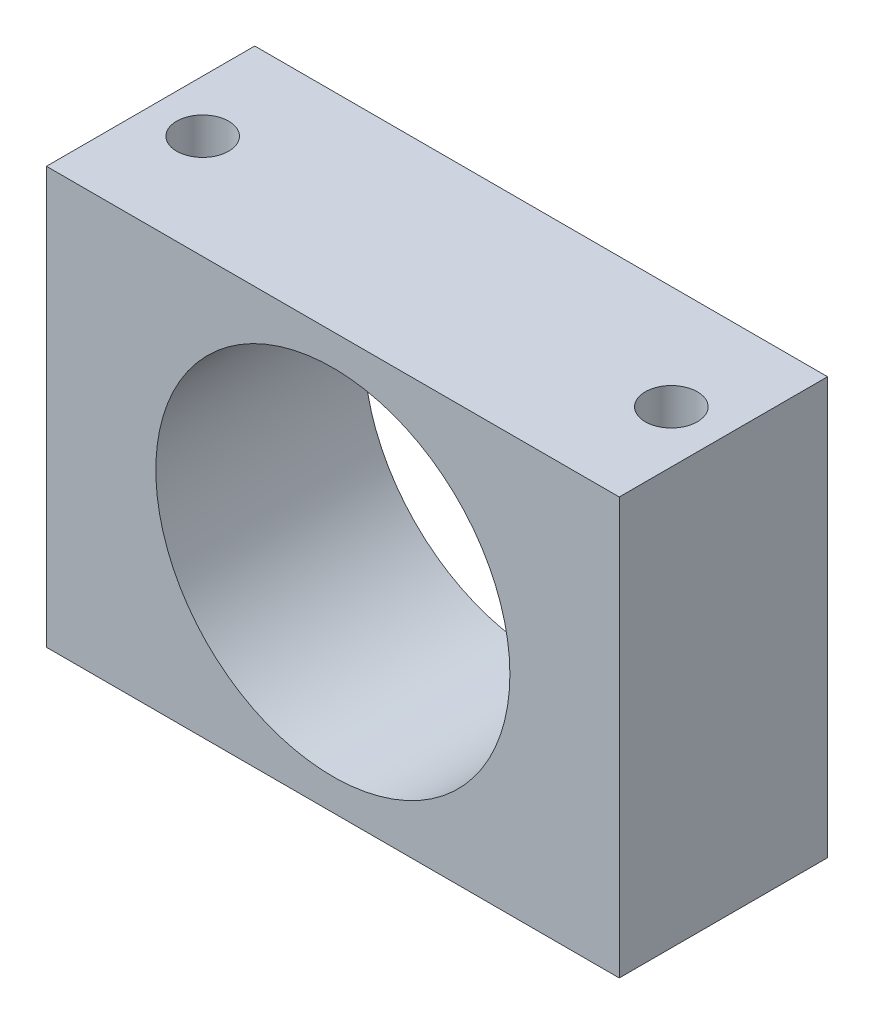
from build123d import *

# Parameters (mm, degrees)
SKETCH1_W                 = 55
SKETCH1_H                 = 40
SKETCH1_R                 = 17
BOSS_EXTRUDE1_DEPTH       = 20
M6_TAPPED_HOLE1_D         = 5
M6_TAPPED_HOLE1_DEPTH     = 17
M6_TAPPED_HOLE1_TIP       = 1.502151548
M4X0_7_TAPPED_HOLE3_D     = 3.3
M4X0_7_TAPPED_HOLE3_DEPTH = 12
M4X0_7_TAPPED_HOLE3_TIP   = 0.991420021


with BuildPart() as part:
    # Sketch1 → Boss-Extrude1 (new body)
    with BuildSketch(Plane.XY):
        Rectangle(SKETCH1_W, SKETCH1_H)
        Circle(SKETCH1_R, mode=Mode.SUBTRACT)
    extrude(amount=BOSS_EXTRUDE1_DEPTH)

    # M6 Tapped Hole1
    with Locations(Plane(origin=(0, 20, 0), x_dir=(1, 0, 0), z_dir=(0, 1, 0))):
        with Locations((-22.5, -10), (22.5, -10)):
            Hole(M6_TAPPED_HOLE1_D / 2, depth=M6_TAPPED_HOLE1_DEPTH)
            with Locations((0, 0, -(M6_TAPPED_HOLE1_DEPTH + M6_TAPPED_HOLE1_TIP / 2))):  # 118° drill point
                Cone(0, M6_TAPPED_HOLE1_D / 2, M6_TAPPED_HOLE1_TIP, mode=Mode.SUBTRACT)

    # M4x0.7 Tapped Hole3
    with Locations(Plane(origin=(-5.289478712, -11.13007226, 0), x_dir=(-1, 0, 0), z_dir=(0, 0, -1))):
        with Locations((-24.342037596, 0.13007226), (-24.342037596, 22.13007226), (-5.289478712, 33.13007226), (13.763080171, 22.13007226)):
            Hole(M4X0_7_TAPPED_HOLE3_D / 2, depth=M4X0_7_TAPPED_HOLE3_DEPTH)
            with Locations((0, 0, -(M4X0_7_TAPPED_HOLE3_DEPTH + M4X0_7_TAPPED_HOLE3_TIP / 2))):  # 118° drill point
                Cone(0, M4X0_7_TAPPED_HOLE3_D / 2, M4X0_7_TAPPED_HOLE3_TIP, mode=Mode.SUBTRACT)


solid = part.part
